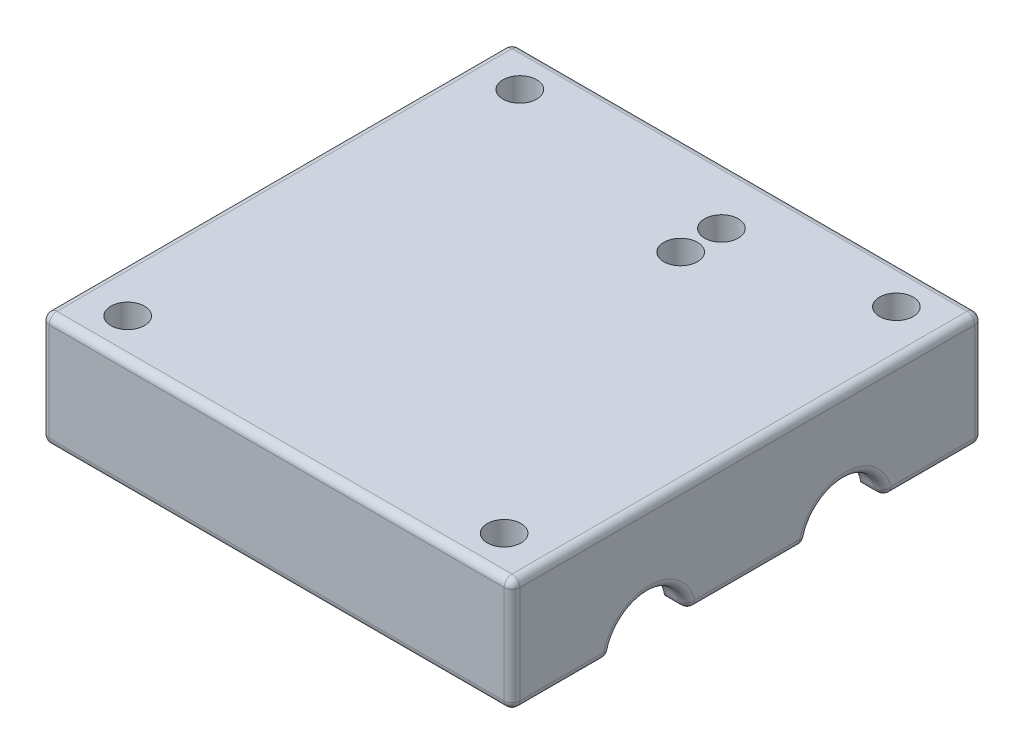
from build123d import *
from build123d.topology import SkipClean

# Parameters (mm, degrees)
SKETCH1_W           = 60
SKETCH1_H           = 60
BOSS_EXTRUDE1_DEPTH = 30
CUT_EXTRUDE1_REACH  = 75.485
SKETCH2_R           = 7.5
SKETCH6_R           = 7.5
BOSS_EXTRUDE2_DEPTH = 1.8
SKETCH3_R           = 2.15
CUT_EXTRUDE2_DEPTH  = 5
SKETCH7_R           = 7.5
SKETCH7_R_2         = 5
BOSS_EXTRUDE3_DEPTH = 3.6
SKETCH4_W           = 60
SKETCH4_H           = 1
CUT_EXTRUDE3_DEPTH  = 74.484692283
SKETCH5_R           = 2.15
CUT_EXTRUDE4_DEPTH  = 8
FILLET2_R           = 1
SKETCH10_R          = 5
CUT_EXTRUDE5_DEPTH  = 74.484692283
SKETCH11_R          = 2.15
L_ARM_HOLES_DEPTH   = 5


with BuildPart() as part:
    # Sketch1 → Boss-Extrude1 (new body)
    with BuildSketch(Plane(origin=(0, 0, 0), x_dir=(1, 0, 0), z_dir=(0, 1, 0))):
        Rectangle(SKETCH1_W, SKETCH1_H)
    extrude(amount=BOSS_EXTRUDE1_DEPTH)

    # Sketch2 → Cut-Extrude1 (cut, up to next)
    with BuildSketch(Plane(origin=(30, 0, 0), x_dir=(0, 0, -1), z_dir=(1, 0, 0)), mode=Mode.PRIVATE) as cut_extrude1_sk1:
        with Locations((-12.5, 15)):
            Circle(SKETCH2_R)
    cut_extrude1_tool1 = extrude(cut_extrude1_sk1.sketch, amount=-CUT_EXTRUDE1_REACH, mode=Mode.PRIVATE) & part.part
    # Sketch2 → Cut-Extrude1 (cut, up to next)
    with BuildSketch(Plane(origin=(30, 0, 0), x_dir=(0, 0, -1), z_dir=(1, 0, 0)), mode=Mode.PRIVATE) as cut_extrude1_sk2:
        with Locations((12.5, 15)):
            Circle(SKETCH2_R)
    cut_extrude1_tool2 = extrude(cut_extrude1_sk2.sketch, amount=-CUT_EXTRUDE1_REACH, mode=Mode.PRIVATE) & part.part
    add(cut_extrude1_tool1.solids().sort_by_distance((30, 15, 12.5))[0], mode=Mode.SUBTRACT)
    add(cut_extrude1_tool2.solids().sort_by_distance((30, 15, -12.5))[0], mode=Mode.SUBTRACT)

    # Sketch6 → Boss-Extrude2 (add, symmetric)
    with BuildSketch(Plane(origin=(0, 0, 0), x_dir=(0, 0, -1), z_dir=(1, 0, 0))):
        with Locations((12.5, 15)):
            Circle(SKETCH6_R)
        with Locations((-12.5, 15)):
            Circle(SKETCH6_R)
    extrude(amount=BOSS_EXTRUDE2_DEPTH, both=True)

    # Sketch3 → Cut-Extrude2 (cut)
    with BuildSketch(Plane(origin=(0, 30, 0), x_dir=(1, 0, 0), z_dir=(0, 1, 0))):
        with Locations(Location((-24, 25, 0), (0, 0, 270))):
            Circle(SKETCH3_R)
        with Locations(Location((-24, -25, 0), (0, 0, 270))):
            Circle(SKETCH3_R)
        with Locations(Location((24, -25, 0), (0, 0, 270))):
            Circle(SKETCH3_R)
        with Locations(Location((24, 25, 0), (0, 0, 270))):
            Circle(SKETCH3_R)
    extrude(amount=-CUT_EXTRUDE2_DEPTH, mode=Mode.SUBTRACT)

    # Sketch7 → Boss-Extrude3 (add)
    # profile 1 of 2: a face of its own
    with BuildSketch(Plane(origin=(30, 0, 0), x_dir=(0, 0, -1), z_dir=(1, 0, 0))):
        with Locations((12.5, 15)):
            Circle(SKETCH7_R)
        with Locations((12.5, 15)):
            Circle(SKETCH7_R_2, mode=Mode.SUBTRACT)
    # profile 2 of 2: a face of its own
    with BuildSketch(Plane(origin=(30, 0, 0), x_dir=(0, 0, -1), z_dir=(1, 0, 0))):
        with Locations((-12.5, 15)):
            Circle(SKETCH7_R)
        with Locations((-12.5, 15)):
            Circle(SKETCH7_R_2, mode=Mode.SUBTRACT)
    boss_extrude3 = extrude(amount=-BOSS_EXTRUDE3_DEPTH)

    # Mirror1: Boss-Extrude3 across plane
    add(boss_extrude3.mirror(Plane(origin=(0, 0, 0), x_dir=(0, 0, 1), z_dir=(1, 0, 0))))

    # Sketch4 → Cut-Extrude3 (cut, through all)
    with BuildSketch(Plane(origin=(30, 0, 0), x_dir=(0, 0, -1), z_dir=(1, 0, 0))):
        with Locations((0, 15)):
            Rectangle(SKETCH4_W, SKETCH4_H)
    extrude(amount=-CUT_EXTRUDE3_DEPTH, mode=Mode.SUBTRACT)


with BuildPart() as cut_extrude3_kept_piece:
    # of the separate pieces the step leaves, the one the design keeps (cut_extrude3_pieces_kept)
    add(part.part.solids().sort_by_distance((30, 15.5, 30))[0])

    # Sketch5 → Cut-Extrude4 (cut)
    with BuildSketch(Plane.XZ.offset(-15.5)):
        with Locations(Location((18, 24.991657387, 0), (0, 0, 270))):
            Circle(SKETCH5_R)
        with Locations(Location((-18, 24.991657387, 0), (0, 0, 270))):
            Circle(SKETCH5_R)
        with Locations(Location((-18, 0, 0), (0, 0, 270))):
            Circle(SKETCH5_R)
        with Locations(Location((18, 0, 0), (0, 0, 270))):
            Circle(SKETCH5_R)
        with Locations(Location((18, -24.991657387, 0), (0, 0, 270))):
            Circle(SKETCH5_R)
        with Locations(Location((-18, -24.991657387, 0), (0, 0, 270))):
            Circle(SKETCH5_R)
    extrude(amount=-CUT_EXTRUDE4_DEPTH, mode=Mode.SUBTRACT)

    # Fillet2
    fillet2_edges = [cut_extrude3_kept_piece.edges().sort_by_distance(p)[0] for p in [
        (30, 22.75, 30),
        (30, 22.75, -30),
        (-30, 22.75, -30),
        (-30, 15.5, -23.737468593),
        (-30, 20, -12.5),
        (-30, 15.5, 0),
        (-30, 20, 12.5),
        (-30, 15.5, 23.737468593),
        (-30, 22.75, 30),
        (0, 15.5, 30),
        (30, 30, 0),
        (0, 30, -30),
        (-30, 30, 0),
        (0, 30, 30),
        (26.4, 20, 12.5),
        (30, 20, 12.5),
        (28.2, 15.5, 17.474937186),
        (28.2, 15.5, 7.525062814),
        (26.4, 20, -12.5),
        (30, 20, -12.5),
        (28.2, 15.5, -7.525062814),
        (28.2, 15.5, -17.474937186),
        (-26.4, 20, 12.5),
        (-26.4, 20, -12.5),
        (30, 15.5, 23.737468593),
        (-28.2, 15.5, 17.474937186),
        (-28.2, 15.5, 7.525062814),
        (-28.2, 15.5, -7.525062814),
        (-28.2, 15.5, -17.474937186),
        (0, 15.5, -30),
        (30, 15.5, -23.737468593),
        (30, 15.5, 0),
    ]]
    fillet(fillet2_edges, radius=FILLET2_R)

    # Sketch10 → Cut-Extrude5 (cut, through all)
    with SkipClean():  # the faces are left unmerged after this step: merging them gives an invalid solid
        with BuildSketch(Plane(origin=(30, 0, 0), x_dir=(0, 0, -1), z_dir=(1, 0, 0))):
            with Locations((-12.5, 15)):
                Circle(SKETCH10_R)
            with Locations((12.5, 15)):
                Circle(SKETCH10_R)
        extrude(amount=-CUT_EXTRUDE5_DEPTH, mode=Mode.SUBTRACT)

    # Sketch11 → L-Arm Holes (cut)
    with SkipClean():  # the faces are left unmerged after this step: merging them gives an invalid solid
        with BuildSketch(Plane(origin=(0, 30, 0), x_dir=(1, 0, 0), z_dir=(0, 1, 0))):
            with Locations(Location((4.2, 22.5, 0), (0, 0, 270))):
                Circle(SKETCH11_R)
            with Locations(Location((4.2, 17.3, 0), (0, 0, 270))):
                Circle(SKETCH11_R)
        extrude(amount=-L_ARM_HOLES_DEPTH, mode=Mode.SUBTRACT)


solid = cut_extrude3_kept_piece.part
